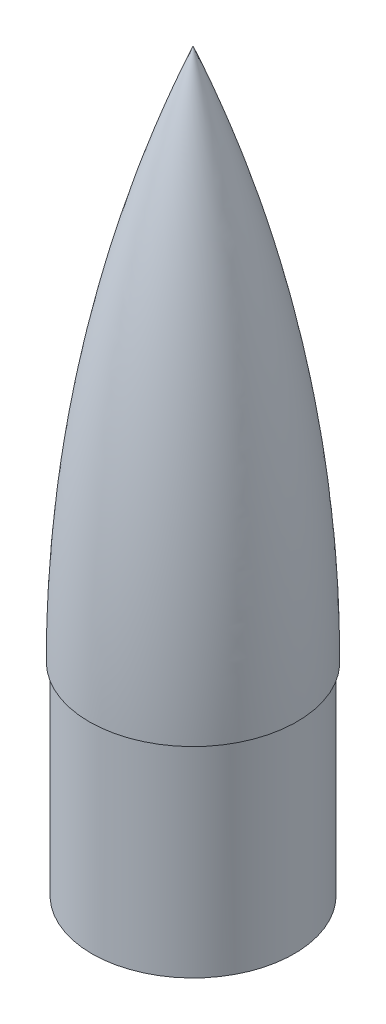
from build123d import *

# Parameters (mm, degrees)
BOSS_EXTRUDE1_DEPTH      = 10
BOSS_EXTRUDE1_DEPTH_BACK = 152.4
SKETCH2_R                = 76.2
SKETCH2_R_2              = 74.2


with BuildPart() as part:
    # Sketch1 → Revolve3 (revolve)
    with BuildSketch(Plane.XY):
        with BuildLine():
            Line((0, 400), (0, 401.853426775))
            ThreePointArc((0, 401.853426775), (58.468341276, 204.695759977), (78.2, 0))
            Line((78.2, 0), (76.2, 0))
            ThreePointArc((76.2, 0), (56.977268898, 201.872568324), (0, 396.489212171))
            Line((0, 396.489212171), (0, 400))
        make_face()
    revolve(axis=Axis((0, 400, 0), (0, 1, 0)))

    # Sketch2 → Boss-Extrude1 (add, two sides: drawn at the far end of the back side and taken through both)
    with BuildSketch(Plane(origin=(0, 0, 0), x_dir=(1, 0, 0), z_dir=(0, 1, 0)).offset(-BOSS_EXTRUDE1_DEPTH_BACK)):
        with Locations(Location((0, 0, 0), (0, 0, 90))):
            Circle(SKETCH2_R)
        with Locations(Location((0, 0, 0), (0, 0, 270))):
            Circle(SKETCH2_R_2, mode=Mode.SUBTRACT)
    extrude(amount=BOSS_EXTRUDE1_DEPTH + BOSS_EXTRUDE1_DEPTH_BACK)


solid = part.part
